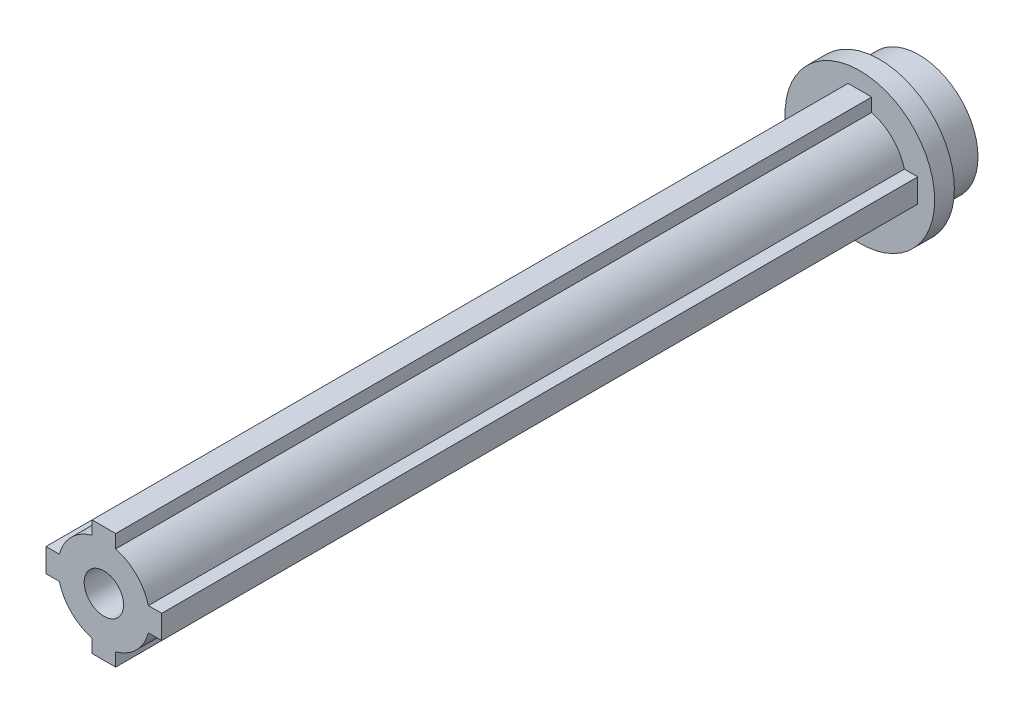
from build123d import *

# Parameters (mm, degrees)
SKETCH1_R           = 7.5
BOSS_EXTRUDE1_DEPTH = 5
SKETCH3_R           = 9.5
BOSS_EXTRUDE2_DEPTH = 2.5
BOSS_EXTRUDE3_DEPTH = 96
SKETCH5_R           = 2.5
CUT_EXTRUDE1_DEPTH  = 5


with BuildPart() as part:
    # Sketch1 → Boss-Extrude1 (new body)
    with BuildSketch(Plane.XY):
        Circle(SKETCH1_R)
    extrude(amount=BOSS_EXTRUDE1_DEPTH)

    # Sketch3 → Boss-Extrude2 (add)
    with BuildSketch(Plane.XY.offset(5)):
        Circle(SKETCH3_R)
    extrude(amount=BOSS_EXTRUDE2_DEPTH)

    # Sketch4 → Boss-Extrude3 (add)
    with BuildSketch(Plane.XY.offset(7.5)):
        with BuildLine():
            Line((-1.5, 5.652839314), (-1.5, 7.348469228))
            Line((-1.5, 7.348469228), (1.5, 7.348469228))
            Line((1.5, 7.348469228), (1.5, 5.652839314))
            ThreePointArc((1.5, 5.652839314), (4.135492251, 4.135492251), (5.652839314, 1.5))
            Line((5.652839314, 1.5), (7.348469228, 1.5))
            Line((7.348469228, 1.5), (7.348469228, -1.5))
            Line((7.348469228, -1.5), (5.652839314, -1.5))
            ThreePointArc((5.652839314, -1.5), (4.135492251, -4.135492251), (1.5, -5.652839314))
            Line((1.5, -5.652839314), (1.5, -7.348469228))
            Line((1.5, -7.348469228), (-1.5, -7.348469228))
            Line((-1.5, -7.348469228), (-1.5, -5.652839314))
            ThreePointArc((-1.5, -5.652839314), (-4.135492251, -4.135492251), (-5.652839314, -1.5))
            Line((-5.652839314, -1.5), (-7.348469228, -1.5))
            Line((-7.348469228, -1.5), (-7.348469228, 1.5))
            Line((-7.348469228, 1.5), (-5.652839314, 1.5))
            ThreePointArc((-5.652839314, 1.5), (-4.135492251, 4.135492251), (-1.5, 5.652839314))
        make_face()
    extrude(amount=BOSS_EXTRUDE3_DEPTH)

    # Sketch5 → Cut-Extrude1 (cut)
    with BuildSketch(Plane.XY.offset(103.5)):
        Circle(SKETCH5_R)
    extrude(amount=-CUT_EXTRUDE1_DEPTH, mode=Mode.SUBTRACT)


solid = part.part
